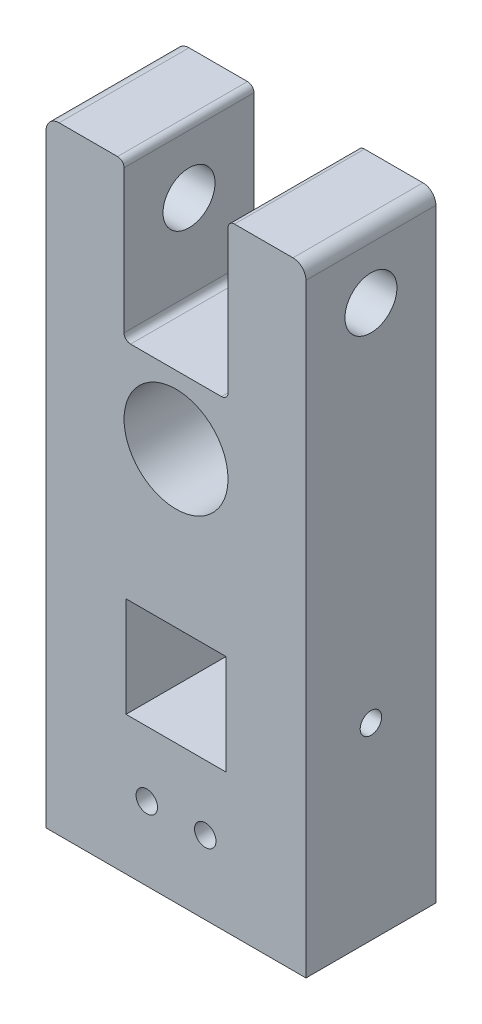
from build123d import *

# Parameters (mm, degrees)
SKETCH_1_W          = 40
SKETCH_1_H          = 69
EXTRUDE_1_DEPTH     = 20
SKETCH_2_R          = 8
CUT_EXTRUDE_1_DEPTH = 20
SKETCH_3_W          = 40
SKETCH_3_H          = 20
EXTRUDE_2_DEPTH     = 26
SKETCH_8_W          = 15.4
SKETCH_8_H          = 15.4
CUT_EXTRUDE_6_DEPTH = 100
SKETCH_4_R          = 1.65
CUT_EXTRUDE_2_DEPTH = 40
SKETCH_5_W          = 5
SKETCH_5_H          = 5
CUT_EXTRUDE_3_DEPTH = 6
FILLET_1_R          = 2
SKETCH_6_W          = 16
SKETCH_6_H          = 24
CUT_EXTRUDE_4_DEPTH = 50
SKETCH_7_R          = 4
CUT_EXTRUDE_5_DEPTH = 100
FILLET_2_R          = 1
SKETCH_9_R          = 1.65
CUT_EXTRUDE_7_DEPTH = 1000


with BuildPart() as part:
    # 草图1 → 凸台-拉伸1 (new body)
    with BuildSketch(Plane.XY):
        Rectangle(SKETCH_1_W, SKETCH_1_H)
    extrude(amount=EXTRUDE_1_DEPTH)

    # 草图2 → 切除-拉伸1 (cut)
    with BuildSketch(Plane.XY.offset(20)):
        Circle(SKETCH_2_R)
    extrude(amount=-CUT_EXTRUDE_1_DEPTH, mode=Mode.SUBTRACT)

    # 草图3 → 凸台-拉伸2 (add)
    with BuildSketch(Plane.XZ.offset(34.5)):
        with Locations((0, 10)):
            Rectangle(SKETCH_3_W, SKETCH_3_H)
    extrude(amount=EXTRUDE_2_DEPTH)

    # 草图8 → 切除-拉伸6 (cut)
    with BuildSketch(Plane.XY.offset(20)):
        with Locations((0, -31.5)):
            Rectangle(SKETCH_8_W, SKETCH_8_H)
    extrude(amount=-CUT_EXTRUDE_6_DEPTH, mode=Mode.SUBTRACT)

    # 草图4 → 切除-拉伸2 (cut)
    with BuildSketch(Plane.XY.offset(20)):
        with Locations((4.5, -49.2)):
            Circle(SKETCH_4_R)
        with Locations((-4.5, -49.2)):
            Circle(SKETCH_4_R)
    extrude(amount=-CUT_EXTRUDE_2_DEPTH, mode=Mode.SUBTRACT)

    # 草图5 → 切除-拉伸3 (cut)
    with BuildSketch(Plane.XZ.offset(60.5)):
        with Locations((0, 12)):
            Rectangle(SKETCH_5_W, SKETCH_5_H)
    extrude(amount=-CUT_EXTRUDE_3_DEPTH, mode=Mode.SUBTRACT)

    # 圆角1
    fillet_1_edges = [part.edges().sort_by_distance(p)[0] for p in [
        (-20, 34.5, 10),
        (20, 34.5, 10),
    ]]
    fillet(fillet_1_edges, radius=FILLET_1_R)

    # 草图6 → 切除-拉伸4 (cut)
    with BuildSketch(Plane.XY.offset(20)):
        with Locations((0, 22.5)):
            Rectangle(SKETCH_6_W, SKETCH_6_H)
    extrude(amount=-CUT_EXTRUDE_4_DEPTH, mode=Mode.SUBTRACT)

    # 草图7 → 切除-拉伸5 (cut)
    with BuildSketch(Plane(origin=(20, 0, 0), x_dir=(0, 0, -1), z_dir=(1, 0, 0))):
        with Locations((-10, 24.5)):
            Circle(SKETCH_7_R)
    extrude(amount=-CUT_EXTRUDE_5_DEPTH, mode=Mode.SUBTRACT)

    # 圆角2
    fillet_2_edges = [part.edges().sort_by_distance(p)[0] for p in [
        (-8, 34.5, 10),
        (8, 34.5, 10),
        (8, 10.5, 10),
        (-8, 10.5, 10),
    ]]
    fillet(fillet_2_edges, radius=FILLET_2_R)

    # 草图9 → 切除-拉伸7 (cut)
    with BuildSketch(Plane(origin=(20, 0, 0), x_dir=(0, 0, -1), z_dir=(1, 0, 0))):
        with Locations((-10, -31.5)):
            Circle(SKETCH_9_R)
    extrude(amount=-CUT_EXTRUDE_7_DEPTH, mode=Mode.SUBTRACT)


solid = part.part
